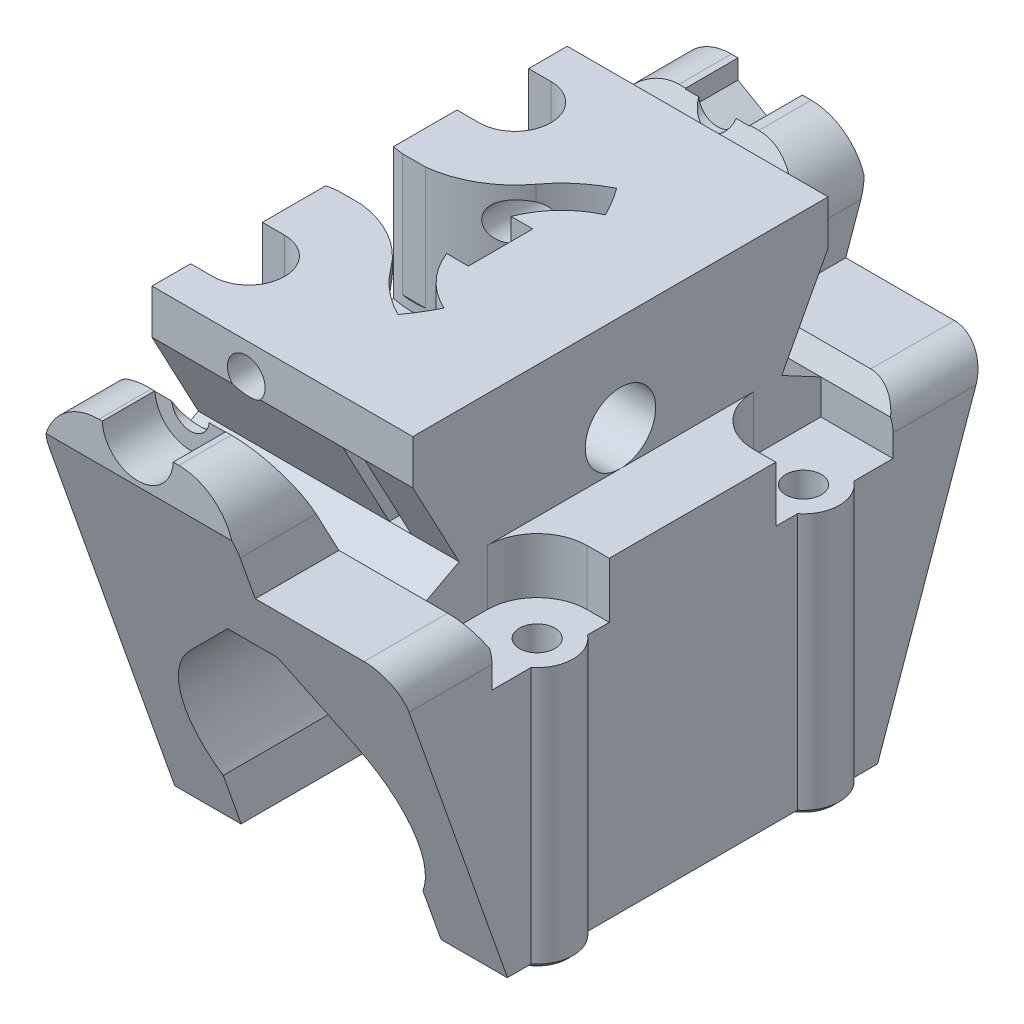
from build123d import *
from OCP.BRepFilletAPI import BRepFilletAPI_MakeChamfer

# Parameters (mm, degrees)
BOSS_EXTRUDE1_DEPTH      = 30
CHAMFER4_SIZE            = 34
CHAMFER4_SIZE2           = 12
CHAMFER3_SIZE            = 12
CHAMFER3_SIZE2           = 34
CUT_EXTRUDE1_DEPTH       = 72.056315694
SKETCH4_R                = 1.6
CUT_EXTRUDE2_DEPTH       = 58.900777197
BOSS_EXTRUDE2_DEPTH      = 40.5
CUT_EXTRUDE6_START       = -7
CUT_EXTRUDE6_DEPTH       = 7
CUT_EXTRUDE7_DEPTH       = 11.856765
BOSS_EXTRUDE3_DEPTH      = 4
CUT_EXTRUDE9_DEPTH       = 5
CUT_EXTRUDE10_DEPTH      = 52.841550158
CUT_EXTRUDE10_DEPTH_BACK = 52.841550158
SKETCH12_R               = 1.7
CUT_EXTRUDE11_DEPTH      = 12.8
SKETCH14_R               = 1.7
CUT_EXTRUDE12_DEPTH      = 49.207662026
SKETCH15_R               = 3.175
CUT_EXTRUDE13_DEPTH      = 6
CUT_EXTRUDE14_DEPTH      = 47.416589093
CUT_EXTRUDE14_DEPTH_BACK = 2.5
CUT_EXTRUDE15_DEPTH      = 4.75
CUT_EXTRUDE16_DEPTH      = 4.75
FILLET1_R                = 5
FILLET2_R                = 3
CHAMFER2_SIZE            = 0.5
CHAMFER2_SIZE2           = 0.819443472


with BuildPart() as part:
    # Sketch2 → Boss-Extrude1 (new body)
    with BuildSketch(Plane(origin=(0, 0, 0), x_dir=(0, 0, -1), z_dir=(1, 0, 0))):
        Polygon((-28.5, -10.5), (28.5, -10.5), (28.5, 27), (23.779726516, 27), (18.067189942, 16.264260874), (14.535978222, 18.143235006), (18.71659931, 26), (18.71659931, 30), (-18.71659931, 30), (-18.71659931, 26), (-14.535978222, 18.143235006), (-18.067189942, 16.264260874), (-23.779726516, 27), (-28.5, 27), align=None)
    extrude(amount=BOSS_EXTRUDE1_DEPTH)

    # Chamfer4
    chamfer4_edges = [part.edges().sort_by_distance(p)[0] for p in [
        (15, -10.5, 28.5),
    ]]
    chamfer4_side = [part.faces().sort_by_distance(p)[0] for p in [
        (15, 8.25, 28.5),
    ]]
    chamfer(chamfer4_edges, length=CHAMFER4_SIZE, length2=CHAMFER4_SIZE2, reference=chamfer4_side[0])

    # Chamfer3
    chamfer3_edges = [part.edges().sort_by_distance(p)[0] for p in [
        (15, -10.5, -28.5),
    ]]
    chamfer3_side = [part.faces().sort_by_distance(p)[0] for p in [
        (15, -10.5, -6),
    ]]
    chamfer(chamfer3_edges, length=CHAMFER3_SIZE, length2=CHAMFER3_SIZE2, reference=chamfer3_side[0])

    # Sketch3 → Cut-Extrude1 (cut, through all)
    with BuildSketch(Plane(origin=(0, 0, -28.5), x_dir=(-1, 0, 0), z_dir=(0, 0, -1))):
        with BuildLine():
            Line((-24, -5.408326913), (-24, -10.5))
            Line((-24, -10.5), (-6, -10.5))
            Line((-6, -10.5), (-6, -5.408326913))
            ThreePointArc((-6, -5.408326913), (-4.578235047, 1.279380809), (-7.575378798, 7.424621202))
            Line((-7.575378798, 7.424621202), (-12.750757595, 12.6))
            Line((-12.750757595, 12.6), (-17.249242405, 12.6))
            Line((-17.249242405, 12.6), (-22.424621202, 7.424621202))
            ThreePointArc((-22.424621202, 7.424621202), (-25.421764953, 1.279380809), (-24, -5.408326913))
        make_face()
    extrude(amount=-CUT_EXTRUDE1_DEPTH, mode=Mode.SUBTRACT)

    # Sketch4 → Cut-Extrude2 (cut, through all)
    with BuildSketch(Plane.XZ.offset(10.5)):
        with Locations(Location((28, 12, 0), (0, 0, 270))):
            Circle(SKETCH4_R)
        with Locations(Location((28, -12, 0), (0, 0, 270))):
            Circle(SKETCH4_R)
        with Locations(Location((2, -12, 0), (0, 0, 270))):
            Circle(SKETCH4_R)
        with Locations(Location((2, 12, 0), (0, 0, 270))):
            Circle(SKETCH4_R)
    extrude(amount=-CUT_EXTRUDE2_DEPTH, mode=Mode.SUBTRACT)

    # Sketch5 → Boss-Extrude2 (add, through all)
    with BuildSketch(Plane.XZ.offset(10.5)):
        with BuildLine():
            Line((30, 14.535978222), (30, 9.464021778))
            ThreePointArc((30, 9.464021778), (31.229734593, 12), (30, 14.535978222))
        make_face()
        with BuildLine():
            Line((0, 14.535978222), (0, 9.464021778))
            ThreePointArc((0, 9.464021778), (-1.229734593, 12), (0, 14.535978222))
        make_face()
        with BuildLine():
            Line((0, -9.464021778), (0, -14.535978222))
            ThreePointArc((0, -14.535978222), (-1.229734593, -12), (0, -9.464021778))
        make_face()
        with BuildLine():
            Line((30, -9.464021778), (30, -14.535978222))
            ThreePointArc((30, -14.535978222), (31.229734593, -12), (30, -9.464021778))
        make_face()
    extrude(amount=-BOSS_EXTRUDE2_DEPTH)

    # Sketch7 → Cut-Extrude6 (cut)
    with BuildSketch(Plane(origin=(0, 30, 0), x_dir=(1, 0, 0), z_dir=(0, 1, 0)).offset(CUT_EXTRUDE6_START)):
        with BuildLine():
            Line((2, 8.770265407), (-1.229734593, 8.770265407))
            Line((-1.229734593, 8.770265407), (-1.229734593, 15.229734593))
            Line((-1.229734593, 15.229734593), (2, 15.229734593))
            ThreePointArc((2, 15.229734593), (5.229734593, 12), (2, 8.770265407))
        make_face()
        with BuildLine():
            Line((31.229734593, 15.229734593), (28, 15.229734593))
            ThreePointArc((28, 15.229734593), (24.770265407, 12), (28, 8.770265407))
            Line((28, 8.770265407), (31.229734593, 8.770265407))
            Line((31.229734593, 8.770265407), (31.229734593, 15.229734593))
        make_face()
        with BuildLine():
            Line((28, -8.770265407), (31.229734593, -8.770265407))
            Line((31.229734593, -8.770265407), (31.229734593, -15.229734593))
            Line((31.229734593, -15.229734593), (28, -15.229734593))
            ThreePointArc((28, -15.229734593), (24.770265407, -12), (28, -8.770265407))
        make_face()
        with BuildLine():
            Line((-1.229734593, -15.229734593), (2, -15.229734593))
            ThreePointArc((2, -15.229734593), (5.229734593, -12), (2, -8.770265407))
            Line((2, -8.770265407), (-1.229734593, -8.770265407))
            Line((-1.229734593, -8.770265407), (-1.229734593, -15.229734593))
        make_face()
    extrude(amount=CUT_EXTRUDE6_DEPTH, mode=Mode.SUBTRACT)

    # Sketch8 → Cut-Extrude7 (cut)
    with BuildSketch(Plane(origin=(0, 30, 0), x_dir=(1, 0, 0), z_dir=(0, 1, 0))):
        with BuildLine():
            Line((19.2, -29.957687111), (17.2, -29.957687111))
            Line((17.2, -29.957687111), (17.2, -13.416407865))
            ThreePointArc((17.2, -13.416407865), (16.605351177, -11.623564951), (15.057142857, -10.541463322))
            ThreePointArc((15.057142857, -10.541463322), (11.884944308, -9.006668175), (9.360870873, -6.547503057))
            ThreePointArc((9.360870873, -6.547503057), (-0.870882867, -3.301139472), (-7.16035714, -12))
            Line((-7.16035714, -12), (-7.16035714, -28.5))
            Line((-7.16035714, -28.5), (-15.48862731, -28.5))
            Line((-15.48862731, -28.5), (-15.48862731, 28.5))
            Line((-15.48862731, 28.5), (-7.16035714, 28.5))
            Line((-7.16035714, 28.5), (-7.16035714, 12))
            ThreePointArc((-7.16035714, 12), (-0.870882867, 3.301139472), (9.360870873, 6.547503057))
            ThreePointArc((9.360870873, 6.547503057), (11.884944308, 9.006668175), (15.057142857, 10.541463322))
            ThreePointArc((15.057142857, 10.541463322), (16.605351177, 11.623564951), (17.2, 13.416407865))
            Line((17.2, 13.416407865), (17.2, 29.957687111))
            Line((17.2, 29.957687111), (19.2, 29.957687111))
            Line((19.2, 29.957687111), (23.5, 29.957687111))
            Line((23.5, 29.957687111), (34.5, 29.957687111))
            Line((34.5, 29.957687111), (34.5, -29.957687111))
            Line((34.5, -29.957687111), (23.5, -29.957687111))
            Line((23.5, -29.957687111), (19.2, -29.957687111))
        make_face()
        with BuildLine():
            Line((19.2, -18.71659931), (19.2, -10.816653826))
            ThreePointArc((19.2, -10.816653826), (18.506118344, -8.897847379), (16.745454545, -7.866657328))
            ThreePointArc((16.745454545, -7.866657328), (10.2, 0), (16.745454545, 7.866657328))
            ThreePointArc((16.745454545, 7.866657328), (18.506118344, 8.897847379), (19.2, 10.816653826))
            Line((19.2, 10.816653826), (19.2, 19.780808584))
            Line((19.2, 19.780808584), (23.50341466, 18.71659931))
            Line((23.50341466, 18.71659931), (23.50341466, -18.71659931))
            Line((23.50341466, -18.71659931), (19.2, -18.71659931))
        make_face(mode=Mode.SUBTRACT)
    extrude(amount=-CUT_EXTRUDE7_DEPTH, mode=Mode.SUBTRACT)

    # Sketch10 → Boss-Extrude3 (add)
    with BuildSketch(Plane(origin=(0, 30, 0), x_dir=(1, 0, 0), z_dir=(0, 1, 0))):
        with BuildLine():
            Line((5.182198286, 15.723765462), (5.182198286, 18.71659931))
            Line((5.182198286, 18.71659931), (23.50341466, 18.71659931))
            Line((23.50341466, 18.71659931), (23.50341466, -18.71659931))
            Line((23.50341466, -18.71659931), (5.182198286, -18.71659931))
            Line((5.182198286, -18.71659931), (5.182198286, -15.723765462))
            ThreePointArc((5.182198286, -15.723765462), (16.555723463, 0), (5.182198286, 15.723765462))
        make_face()
    extrude(amount=-BOSS_EXTRUDE3_DEPTH)

    # Sketch11 → Cut-Extrude9 (cut)
    with BuildSketch(Plane(origin=(0, 18.143235006, 0), x_dir=(1, 0, 0), z_dir=(0, 1, 0))):
        with BuildLine():
            Line((23.50341466, 12), (23.50341466, 18.067189942))
            Line((23.50341466, 18.067189942), (32.49658534, 18.067189942))
            Line((32.49658534, 18.067189942), (32.49658534, 7.50341466))
            Line((32.49658534, 7.50341466), (28, 7.50341466))
            ThreePointArc((28, 7.50341466), (24.820434014, 8.820434014), (23.50341466, 12))
        make_face()
    cut_extrude9 = extrude(amount=-CUT_EXTRUDE9_DEPTH, mode=Mode.SUBTRACT)

    # Mirror1: Cut-Extrude9 across plane
    add(cut_extrude9.mirror(Plane.XY), mode=Mode.SUBTRACT)

    # Sketch12 → Cut-Extrude10 (cut, two sides: drawn at the far end of the back side and taken through both)
    with BuildSketch(Plane.XY.offset(-CUT_EXTRUDE10_DEPTH_BACK)):
        with Locations(Location((8.5, 27.143235006, 0), (0, 0, 317.740372361))):
            Circle(SKETCH12_R)
    extrude(amount=CUT_EXTRUDE10_DEPTH + CUT_EXTRUDE10_DEPTH_BACK, mode=Mode.SUBTRACT)

    # Sketch13 → Cut-Extrude11 (cut)
    with BuildSketch(Plane(origin=(30, 0, 0), x_dir=(0, 0, -1), z_dir=(1, 0, 0))):
        Polygon((-19.067000791, 18.143235006), (-22.24781103, 24.121025868), (-28.5, 24.121025868), (-28.5, 18.143235006), align=None)
        Polygon((28.5, 18.143235006), (28.5, 24.121025868), (22.24781103, 24.121025868), (19.067000791, 18.143235006), align=None)
    extrude(amount=-CUT_EXTRUDE11_DEPTH, mode=Mode.SUBTRACT)

    # Sketch14 → Cut-Extrude12 (cut, through all)
    with BuildSketch(Plane(origin=(23.50341466, 0, 0), x_dir=(0, 0, -1), z_dir=(1, 0, 0))):
        with Locations((0, 21.318235006)):
            Circle(SKETCH14_R)
    extrude(amount=-CUT_EXTRUDE12_DEPTH, mode=Mode.SUBTRACT)

    # Sketch15 → Cut-Extrude13 (cut)
    with BuildSketch(Plane(origin=(23.50341466, 0, 0), x_dir=(0, 0, -1), z_dir=(1, 0, 0))):
        with Locations((0, 21.318235006)):
            Circle(SKETCH15_R)
    extrude(amount=-CUT_EXTRUDE13_DEPTH, mode=Mode.SUBTRACT)

    # Sketch16 → Cut-Extrude14 (cut, two sides: drawn at the far end of the back side and taken through both)
    with BuildSketch(Plane.ZY.offset(-10.2).offset(-CUT_EXTRUDE14_DEPTH_BACK)):
        Polygon((-2.9, 30), (2.9, 30), (2.9, 18.989489714), (0, 17.315173933), (-2.9, 18.989489714), align=None)
    extrude(amount=CUT_EXTRUDE14_DEPTH + CUT_EXTRUDE14_DEPTH_BACK, mode=Mode.SUBTRACT)

    # Sketch17 → Cut-Extrude15 (cut)
    with BuildSketch(Plane.XY.offset(28.5)):
        with BuildLine():
            Line((5.3, 27.143235006), (5.3, 31.782206288))
            Line((5.3, 31.782206288), (11.7, 31.782206288))
            Line((11.7, 31.782206288), (11.7, 27.143235006))
            ThreePointArc((11.7, 27.143235006), (8.5, 23.943235006), (5.3, 27.143235006))
        make_face()
    extrude(amount=-CUT_EXTRUDE15_DEPTH, mode=Mode.SUBTRACT)

    # Sketch18 → Cut-Extrude16 (cut)
    with BuildSketch(Plane(origin=(0, 0, -28.5), x_dir=(-1, 0, 0), z_dir=(0, 0, -1))):
        Polygon((-11.4, 31.952405338), (-5.6, 31.952405338), (-5.6, 25.268919225), (-8.5, 23.594603444), (-11.4, 25.268919225), align=None)
    extrude(amount=-CUT_EXTRUDE16_DEPTH, mode=Mode.SUBTRACT)

    # Fillet1
    fillet1_edges = [part.edges().sort_by_distance(p)[0] for p in [
        (0, 27, -26.139863258),
        (17.2, 27, -26.139863258),
        (17.2, 27, 26.139863258),
        (0, 27, 26.139863258),
    ]]
    fillet(fillet1_edges, radius=FILLET1_R)

    # Fillet2
    fillet2_edges = [part.edges().sort_by_distance(p)[0] for p in [
        (30, 18.143235, -22.838188923),
        (30, 18.143235, 22.838188923),
    ]]
    fillet(fillet2_edges, radius=FILLET2_R)

    # Chamfer2: one chamfer whose edges measure the first distance from different faces: ONE call of the kernel's chamfer builder (chamfer() names one face for all edges)
    chamfer2_edges_1 = [part.edges().sort_by_distance(p)[0] for p in [
        (2, -10.5, -10.4),
        (2, -10.5, 13.6),
        (30, -10.5, 0),
        (31.229734593, -10.5, 12),
        (30, -10.5, -15.517989111),
        (31.229734593, -10.5, -12),
        (0, -10.5, -15.517989111),
        (-1.229734593, -10.5, -12),
        (0, -10.5, 0),
        (-1.229734593, -10.5, 12),
        (0, -10.5, 15.517989111),
        (30, -10.5, 15.517989111),
        (6, -10.5, 0),
        (24, -10.5, 0),
        (28, -10.5, 13.6),
        (28, -10.5, -10.4),
    ]]
    chamfer2_edges_2 = [part.edges().sort_by_distance(p)[0] for p in [
        (27, -10.5, 16.5),
        (3, -10.5, 16.5),
    ]]
    chamfer2_side_2 = [part.faces().sort_by_distance(p)[0] for p in [
        (22.1, 17.700933328, 26.453270586),
    ]]
    chamfer2_edges_3 = [part.edges().sort_by_distance(p)[0] for p in [
        (3, -10.5, -16.5),
        (27, -10.5, -16.5),
    ]]
    chamfer2_side_3 = [part.faces().sort_by_distance(p)[0] for p in [
        (22.1, 17.700933328, -26.453270586),
    ]]
    chamfer2 = BRepFilletAPI_MakeChamfer(part.part.solid().wrapped)
    for e in chamfer2_edges_1:
        chamfer2.Add(CHAMFER2_SIZE, e.wrapped)
    for e in chamfer2_edges_2:
        chamfer2.Add(CHAMFER2_SIZE, CHAMFER2_SIZE2, e.wrapped, chamfer2_side_2[0].wrapped)  # the first distance lies on this face
    for e in chamfer2_edges_3:
        chamfer2.Add(CHAMFER2_SIZE, CHAMFER2_SIZE2, e.wrapped, chamfer2_side_3[0].wrapped)  # the first distance lies on this face
    add(Compound.cast(chamfer2.Shape()), mode=Mode.REPLACE)


solid = part.part
